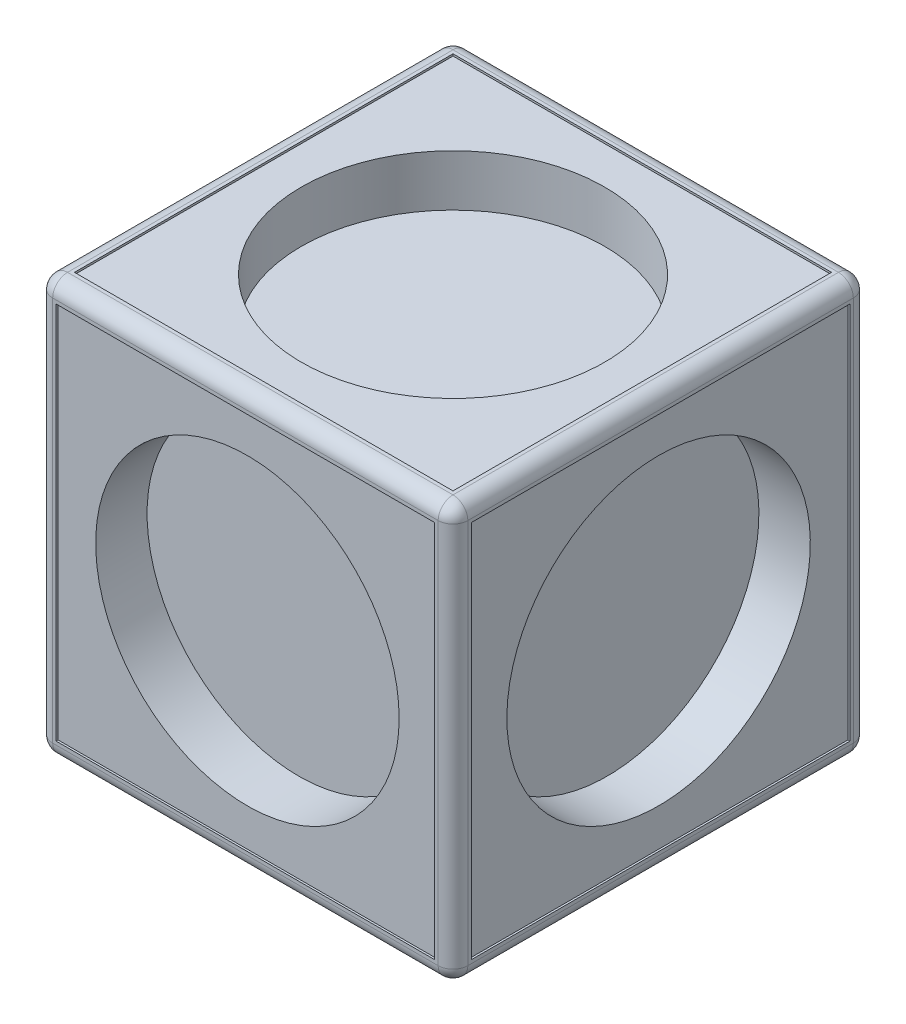
from build123d import *

# Parameters (mm, degrees)
SKETCH2_W           = 42
SKETCH2_H           = 42
BOSS_EXTRUDE1_DEPTH = 42
SKETCH3_R           = 15.35
CUT_EXTRUDE2_DEPTH  = 5.4
SKETCH4_W           = 38.3
SKETCH4_H           = 38.3
CUT_EXTRUDE3_DEPTH  = 0.2
SKETCH5_R           = 15.35
CUT_EXTRUDE4_DEPTH  = 5.4
SKETCH6_W           = 38.3
SKETCH6_H           = 38.3
CUT_EXTRUDE5_DEPTH  = 0.2
SKETCH7_R           = 15.35
CUT_EXTRUDE6_DEPTH  = 5.4
SKETCH8_W           = 38.3
SKETCH8_H           = 38.3
CUT_EXTRUDE7_DEPTH  = 0.2
FILLET1_R           = 1.5


with BuildPart() as part:
    # Sketch2 → Boss-Extrude1 (new body)
    with BuildSketch(Plane.XY):
        Rectangle(SKETCH2_W, SKETCH2_H)
    extrude(amount=BOSS_EXTRUDE1_DEPTH)

    # Sketch3 → Cut-Extrude2 (cut)
    with BuildSketch(Plane(origin=(0, 21, 0), x_dir=(1, 0, 0), z_dir=(0, 1, 0))):
        with Locations(Location((0, -21, 0), (0, 0, 180))):
            Circle(SKETCH3_R)
    cut_extrude2 = extrude(amount=-CUT_EXTRUDE2_DEPTH, mode=Mode.SUBTRACT)

    # Sketch4 → Cut-Extrude3 (cut)
    with BuildSketch(Plane(origin=(0, 21, 0), x_dir=(1, 0, 0), z_dir=(0, 1, 0))):
        with Locations((0, -21)):
            Rectangle(SKETCH4_W, SKETCH4_H)
    cut_extrude3 = extrude(amount=-CUT_EXTRUDE3_DEPTH, mode=Mode.SUBTRACT)

    # Mirror1: Cut-Extrude2, Cut-Extrude3 across plane
    add(cut_extrude2.mirror(Plane.ZX), mode=Mode.SUBTRACT)
    add(cut_extrude3.mirror(Plane.ZX), mode=Mode.SUBTRACT)

    # Sketch5 → Cut-Extrude4 (cut)
    with BuildSketch(Plane(origin=(21, 0, 0), x_dir=(0, 0, -1), z_dir=(1, 0, 0))):
        with Locations(Location((-21, 0, 0), (0, 0, 90))):
            Circle(SKETCH5_R)
    cut_extrude4 = extrude(amount=-CUT_EXTRUDE4_DEPTH, mode=Mode.SUBTRACT)

    # Sketch6 → Cut-Extrude5 (cut)
    with BuildSketch(Plane(origin=(21, 0, 0), x_dir=(0, 0, -1), z_dir=(1, 0, 0))):
        with Locations((-21, 0)):
            Rectangle(SKETCH6_W, SKETCH6_H)
    cut_extrude5 = extrude(amount=-CUT_EXTRUDE5_DEPTH, mode=Mode.SUBTRACT)

    # Sketch7 → Cut-Extrude6 (cut)
    with BuildSketch(Plane.XY.offset(42)):
        Circle(SKETCH7_R)
    cut_extrude6 = extrude(amount=-CUT_EXTRUDE6_DEPTH, mode=Mode.SUBTRACT)

    # Sketch8 → Cut-Extrude7 (cut)
    with BuildSketch(Plane.XY.offset(42)):
        Rectangle(SKETCH8_W, SKETCH8_H)
    cut_extrude7 = extrude(amount=-CUT_EXTRUDE7_DEPTH, mode=Mode.SUBTRACT)

    # Mirror2: Cut-Extrude4, Cut-Extrude5 across plane
    add(cut_extrude4.mirror(Plane(origin=(0, 0, 0), x_dir=(0, 0, 1), z_dir=(1, 0, 0))), mode=Mode.SUBTRACT)
    add(cut_extrude5.mirror(Plane(origin=(0, 0, 0), x_dir=(0, 0, 1), z_dir=(1, 0, 0))), mode=Mode.SUBTRACT)

    # Mirror3: Cut-Extrude6, Cut-Extrude7 across plane
    add(cut_extrude6.mirror(Plane(origin=(0, 0, 21), x_dir=(1, 0, 0), z_dir=(0, 0, -1))), mode=Mode.SUBTRACT)
    add(cut_extrude7.mirror(Plane(origin=(0, 0, 21), x_dir=(1, 0, 0), z_dir=(0, 0, -1))), mode=Mode.SUBTRACT)

    # Fillet1
    fillet1_edges = [part.edges().sort_by_distance(p)[0] for p in [
        (21, 0, 42),
        (0, 21, 42),
        (-21, 0, 42),
        (0, 21, 0),
        (21, 0, 0),
        (0, -21, 0),
        (-21, 0, 0),
        (0, -21, 42),
        (-21, 21, 21),
        (21, 21, 21),
        (21, -21, 21),
        (-21, -21, 21),
    ]]
    fillet(fillet1_edges, radius=FILLET1_R)


solid = part.part
